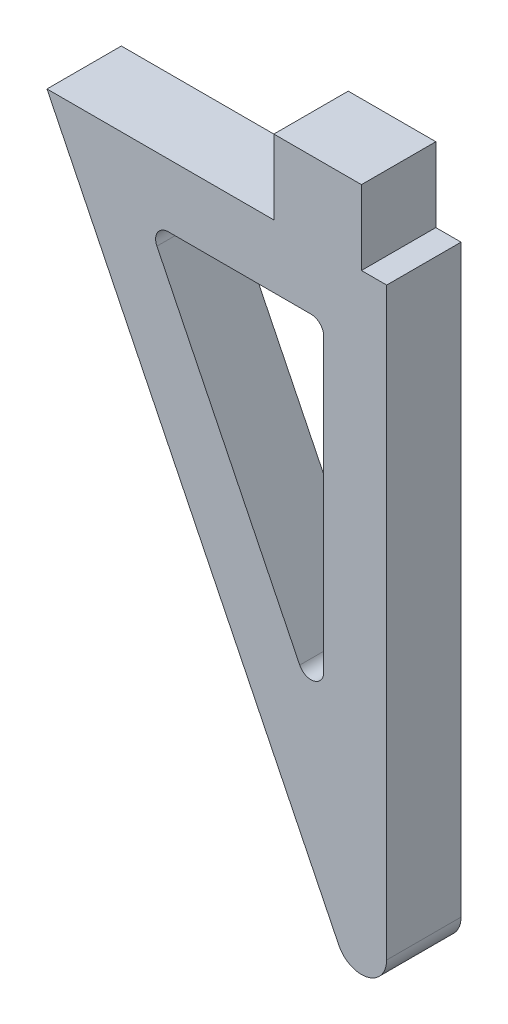
from build123d import *

# Parameters (mm, degrees)
BOSS_EXTRUDE1_DEPTH = 5.9
FILLET1_R           = 2
FILLET2_R           = 1


with BuildPart() as part:
    # Sketch1 → Boss-Extrude1 (new body)
    with BuildSketch(Plane.XY):
        Polygon((0, 0), (6.95, 0), (6.95, -5.9), (8.95, -5.9), (8.95, -60.9), (-18, -5.9), (0, -5.9), align=None)
        Polygon((-9.982011135, -10.9), (3.95, -10.9), (3.95, -39.332675786), align=None, mode=Mode.SUBTRACT)
    extrude(amount=BOSS_EXTRUDE1_DEPTH)

    # Fillet1
    fillet1_edges = [part.edges().sort_by_distance(p)[0] for p in [
        (8.95, -60.9, 2.95),
    ]]
    fillet(fillet1_edges, radius=FILLET1_R)

    # Fillet2
    fillet2_edges = [part.edges().sort_by_distance(p)[0] for p in [
        (-9.982011135, -10.9, 2.95),
        (3.95, -39.332675786, 2.95),
        (3.95, -10.9, 2.95),
    ]]
    fillet(fillet2_edges, radius=FILLET2_R)


solid = part.part
